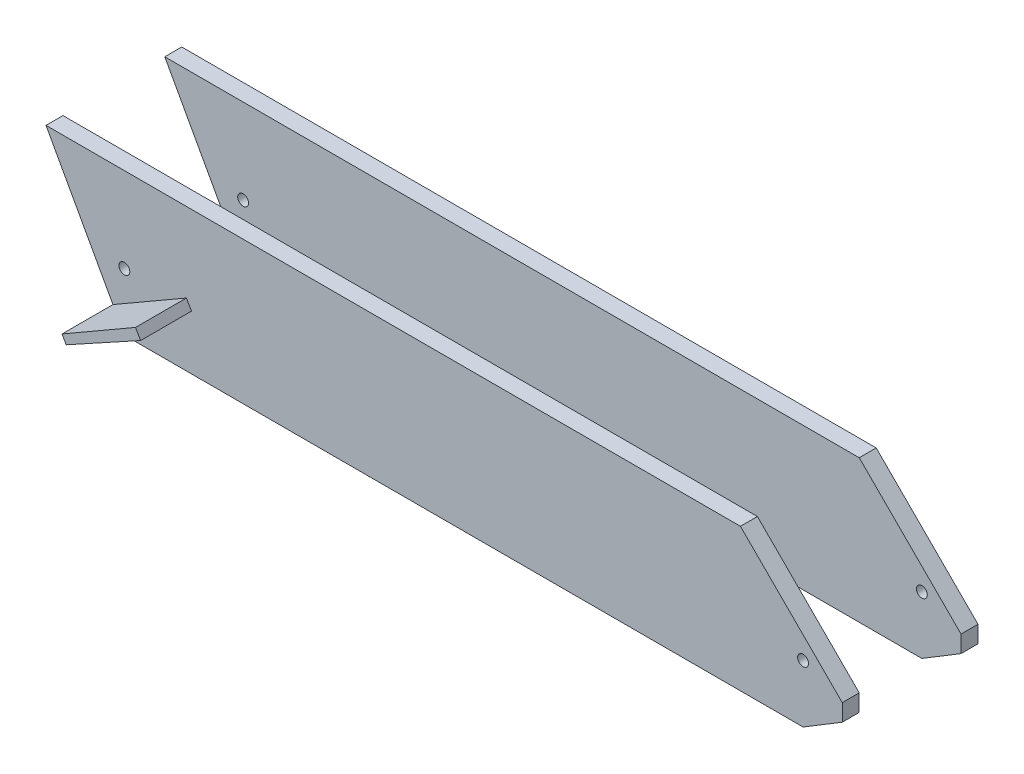
from build123d import *

# Parameters (mm, degrees)
SKETCH1_W           = 200
SKETCH1_H           = 42
BOSS_EXTRUDE1_DEPTH = 40
SKETCH7_W           = 292.37
SKETCH7_H           = 30
CUT_EXTRUDE1_DEPTH  = 35
SKETCH11_R          = 1.6
CUT_EXTRUDE2_DEPTH  = 60
BOSS_EXTRUDE3_DEPTH = 15
CUT_EXTRUDE3_DEPTH  = 50
CUT_EXTRUDE4_REACH  = 223.364
SKETCH16_W          = 215.395
SKETCH16_H          = 30
CHAMFER1_SIZE       = 30
CHAMFER2_SIZE       = 30


with BuildPart() as part:
    # Sketch1 → Boss-Extrude1 (new body)
    with BuildSketch(Plane.XY):
        Polygon((269.28, 0), (200, -42), (200, 0), align=None)
        with Locations((100, -21)):
            Rectangle(SKETCH1_W, SKETCH1_H)
        Polygon((0, 0), (-23.09, 0), (0, -42), align=None)
    extrude(amount=BOSS_EXTRUDE1_DEPTH)

    # Sketch7 → Cut-Extrude1 (cut)
    with BuildSketch(Plane(origin=(0, 0, 0), x_dir=(1, 0, 0), z_dir=(0, 1, 0))):
        with Locations((123.095, -20)):
            Rectangle(SKETCH7_W, SKETCH7_H)
    extrude(amount=-CUT_EXTRUDE1_DEPTH, mode=Mode.SUBTRACT)

    # Sketch11 → Cut-Extrude2 (cut)
    with BuildSketch(Plane.XY.offset(40)):
        with Locations((0, -25)):
            Circle(SKETCH11_R)
        with Locations((200, -25)):
            Circle(SKETCH11_R)
    extrude(amount=-CUT_EXTRUDE2_DEPTH, mode=Mode.SUBTRACT)

    # Sketch12 → Boss-Extrude3 (add)
    with BuildSketch(Plane.XY.offset(40)):
        Polygon((-3.367072415, -35.875398811), (-2.1733684, -38.046709709), (19.784307289, -25.975216098), (18.284502682, -23.377027086), (0.866710605, -33.431447562), align=None)
    extrude(amount=BOSS_EXTRUDE3_DEPTH)

    # Sketch15 → Cut-Extrude3 (cut, symmetric)
    with BuildSketch(Plane(origin=(0, -35, 0), x_dir=(1, 0, 0), z_dir=(0, 1, 0))):
        Polygon((211.546666667, -5), (211.546666667, 0), (269.28, 0), (269.28, -40), (211.546666667, -40), (211.546666667, -35), align=None)
    extrude(amount=CUT_EXTRUDE3_DEPTH, both=True, mode=Mode.SUBTRACT)

    # Sketch16 → Cut-Extrude4 (cut, up to next)
    with BuildSketch(Plane(origin=(0, -35, 0), x_dir=(1, 0, 0), z_dir=(0, 1, 0)), mode=Mode.PRIVATE) as cut_extrude4_sk1:
        with Locations((103.849166667, -20)):
            Rectangle(SKETCH16_W, SKETCH16_H)
    cut_extrude4_tool1 = extrude(cut_extrude4_sk1.sketch, amount=-CUT_EXTRUDE4_REACH, mode=Mode.PRIVATE) & part.part
    add(cut_extrude4_tool1.solids().sort_by_distance((103.849167, -35, 20))[0], mode=Mode.SUBTRACT)


with BuildPart() as cut_extrude4_piece_1:
    # of the separate pieces the step leaves, piece 1, a body of its own (cut_extrude4_pieces)
    add(part.part.solids().sort_by_distance((211.546666667, -35, 35))[0])

    # Chamfer1
    chamfer1_edges = [cut_extrude4_piece_1.edges().sort_by_distance(p)[0] for p in [
        (211.546666667, 0, 37.5),
    ]]
    chamfer(chamfer1_edges, length=CHAMFER1_SIZE)


with BuildPart() as cut_extrude4_piece_2:
    # of the separate pieces the step leaves, piece 2, a body of its own (cut_extrude4_pieces)
    add(part.part.solids().sort_by_distance((211.546666667, -35, 0))[0])

    # Chamfer2
    chamfer2_edges = [cut_extrude4_piece_2.edges().sort_by_distance(p)[0] for p in [
        (211.546666667, 0, 2.5),
    ]]
    chamfer(chamfer2_edges, length=CHAMFER2_SIZE)


solid = Compound([cut_extrude4_piece_1.part, cut_extrude4_piece_2.part])
